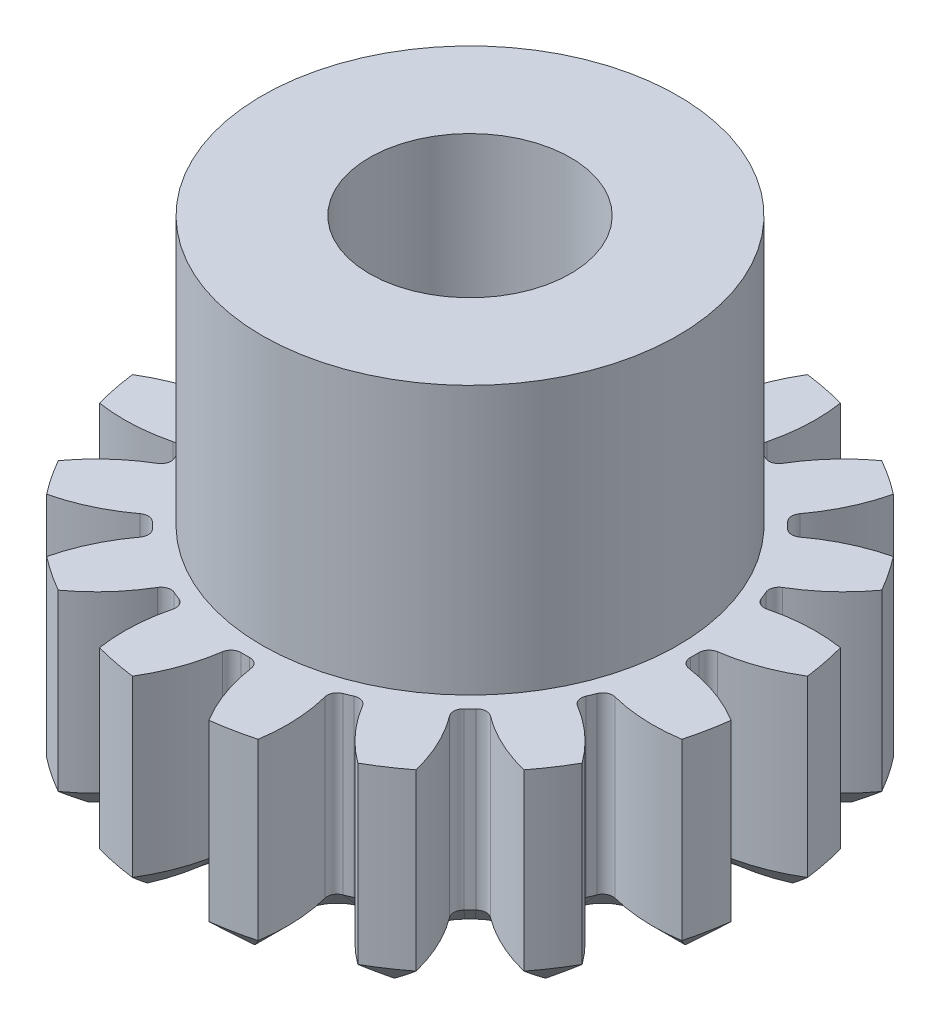
from build123d import *

# Parameters (mm, degrees)
SKETCH1_R                = 4.5
SKETCH1_R_2              = 4
SKETCH1_R_3              = 3.3
BOSS_EXTRUDE1_DEPTH      = 1.5
CUT_EXTRUDE1_DEPTH       = 7.538348415
FILLET2_R                = 0.15
CIRPATTERN1_COUNT        = 16
FILLET2_OF_CIRPATTERN1_R = 0.15
CUT_EXTRUDE2_DEPTH       = 7.488652665
CUT_EXTRUDE2_DEPTH_BACK  = 7.488652665
SKETCH4_R                = 1.5
SKETCH5_R                = 3.1
SKETCH5_R_2              = 1.5
BOSS_EXTRUDE2_DEPTH      = 4
CHAMFER1_SIZE            = 0.4


with BuildPart() as part:
    # Sketch1 → Boss-Extrude1 (new, symmetric)
    # profile 1 of 3: a face of its own
    with BuildSketch(Plane(origin=(0, 0, 0), x_dir=(1, 0, 0), z_dir=(0, 1, 0))):
        with Locations(Location((0, 0, 0), (0, 0, 270))):
            Circle(SKETCH1_R)
        Circle(SKETCH1_R_2, mode=Mode.SUBTRACT)
    # profile 2 of 3: a face of its own
    with BuildSketch(Plane(origin=(0, 0, 0), x_dir=(1, 0, 0), z_dir=(0, 1, 0))):
        Circle(SKETCH1_R_2)
        Circle(SKETCH1_R_3, mode=Mode.SUBTRACT)
    # profile 3 of 3: a face of its own
    with BuildSketch(Plane(origin=(0, 0, 0), x_dir=(1, 0, 0), z_dir=(0, 1, 0))):
        Circle(SKETCH1_R_3)
    extrude(amount=BOSS_EXTRUDE1_DEPTH, both=True)

    # Sketch3 → Cut-Extrude1 (cut, symmetric)
    with BuildSketch(Plane(origin=(0, 0, 0), x_dir=(1, 0, 0), z_dir=(0, 1, 0))):
        with BuildLine():
            ThreePointArc((1.679863237, 5.467765495), (0, 5.72), (-1.679863237, 5.467765495))
            ThreePointArc((-1.679863237, 5.467765495), (-0.658701663, 4.601539237), (-0.198221544, 3.344130413))
            ThreePointArc((-0.198221544, 3.344130413), (0, 3.35), (0.198221544, 3.344130413))
            ThreePointArc((0.198221544, 3.344130413), (0.658701663, 4.601539237), (1.679863237, 5.467765495))
        make_face()
    cut_extrude1 = extrude(amount=CUT_EXTRUDE1_DEPTH, both=True, mode=Mode.SUBTRACT)

    # Fillet2
    fillet2_edges = [part.edges().sort_by_distance(p)[0] for p in [
        (-0.198221544, 0, -3.344130413),
        (0.198221544, 0, -3.344130413),
    ]]
    fillet(fillet2_edges, radius=FILLET2_R)

    # CirPattern1: Cut-Extrude1 ×16 about axis
    cirpattern1_axis = Axis((0, 0, 0), (0, 1, 0))
    for i in range(1, CIRPATTERN1_COUNT):
        add(cut_extrude1.rotate(cirpattern1_axis, i * 360 / CIRPATTERN1_COUNT), mode=Mode.SUBTRACT)

    # Fillet2 of CirPattern1
    fillet2_of_cirpattern1_edges = [part.edges().sort_by_distance(p)[0] for p in [
        (-1.462876132, 0, -3.013717542),
        (-1.096610478, 0, -3.165429743),
        (-2.50482109, 0, -2.224493494),
        (-2.224493494, 0, -2.50482109),
        (-3.165429743, 0, -1.096610478),
        (-3.013717542, 0, -1.462876132),
        (-3.344130413, 0, 0.198221544),
        (-3.344130413, 0, -0.198221544),
        (-3.013717542, 0, 1.462876132),
        (-3.165429743, 0, 1.096610478),
        (-2.224493494, 0, 2.50482109),
        (-2.50482109, 0, 2.224493494),
        (-1.096610478, 0, 3.165429743),
        (-1.462876132, 0, 3.013717542),
        (0.198221544, 0, 3.344130413),
        (-0.198221544, 0, 3.344130413),
        (1.462876132, 0, 3.013717542),
        (1.096610478, 0, 3.165429743),
        (2.50482109, 0, 2.224493494),
        (2.224493494, 0, 2.50482109),
        (3.165429743, 0, 1.096610478),
        (3.013717542, 0, 1.462876132),
        (3.344130413, 0, -0.198221544),
        (3.344130413, 0, 0.198221544),
        (3.013717542, 0, -1.462876132),
        (3.165429743, 0, -1.096610478),
        (2.224493494, 0, -2.50482109),
        (2.50482109, 0, -2.224493494),
        (1.096610478, 0, -3.165429743),
        (1.462876132, 0, -3.013717542),
    ]]
    fillet(fillet2_of_cirpattern1_edges, radius=FILLET2_OF_CIRPATTERN1_R)

    # Sketch4 → Cut-Extrude2 (cut, two sides: drawn at the far end of the back side and taken through both)
    with BuildSketch(Plane(origin=(0, 0, 0), x_dir=(1, 0, 0), z_dir=(0, 1, 0)).offset(-CUT_EXTRUDE2_DEPTH_BACK)):
        with Locations(Location((0, 0, 0), (0, 0, 270))):
            Circle(SKETCH4_R)
    extrude(amount=CUT_EXTRUDE2_DEPTH + CUT_EXTRUDE2_DEPTH_BACK, mode=Mode.SUBTRACT)

    # Sketch5 → Boss-Extrude2 (add)
    with BuildSketch(Plane(origin=(0, 1.5, 0), x_dir=(1, 0, 0), z_dir=(0, 1, 0))):
        with Locations(Location((0, 0, 0), (0, 0, 270))):
            Circle(SKETCH5_R)
        with Locations(Location((0, 0, 0), (0, 0, 270))):
            Circle(SKETCH5_R_2, mode=Mode.SUBTRACT)
    extrude(amount=BOSS_EXTRUDE2_DEPTH)

    # Chamfer1
    chamfer1_edges = [part.edges().sort_by_distance(p)[0] for p in [
        (-1.842208756, -1.5, -3.554329089),
        (-3.06216182, -1.5, -2.578789127),
        (-3.815928505, -1.5, -1.210651898),
        (-3.988754667, -1.5, 0.341796109),
        (-3.554329089, -1.5, 1.842208756),
        (-2.578789127, -1.5, 3.06216182),
        (-1.210651898, -1.5, 3.815928505),
        (0.341796109, -1.5, 3.988754667),
        (1.842208756, -1.5, 3.554329089),
        (3.06216182, -1.5, 2.578789127),
        (3.815928505, -1.5, 1.210651898),
        (3.988754667, -1.5, -0.341796109),
        (3.554329089, -1.5, -1.842208756),
        (2.578789127, -1.5, -3.06216182),
        (1.210651898, -1.5, -3.815928505),
        (0.341796109, -1.5, -3.988754667),
        (0, -1.5, -3.35),
        (0.162785319, -1.5, -3.385033023),
        (-0.162785319, -1.5, -3.385033023),
        (-1.210651898, -1.5, -3.815928505),
        (-1.281989498, -1.5, -3.094996434),
        (-1.145002031, -1.5, -3.189657971),
        (-1.44579008, -1.5, -3.065067482),
        (-2.578789127, -1.5, -3.06216182),
        (-2.368807717, -1.5, -2.368807717),
        (-2.278473202, -1.5, -2.508686408),
        (-2.508686408, -1.5, -2.278473202),
        (-3.554329089, -1.5, -1.842208756),
        (-3.094996434, -1.5, -1.281989498),
        (-3.065067482, -1.5, -1.44579008),
        (-3.189657971, -1.5, -1.145002031),
        (-3.988754667, -1.5, -0.341796109),
        (-3.35, -1.5, 0),
        (-3.385033023, -1.5, -0.162785319),
        (-3.385033023, -1.5, 0.162785319),
        (-3.815928505, -1.5, 1.210651898),
        (-3.094996434, -1.5, 1.281989498),
        (-3.189657971, -1.5, 1.145002031),
        (-3.065067482, -1.5, 1.44579008),
        (-2.500066049, -1.5, -3.741613255),
        (-3.06216182, -1.5, 2.578789127),
        (-2.368807717, -1.5, 2.368807717),
        (-3.741613255, -1.5, -2.500066049),
        (-2.508686408, -1.5, 2.278473202),
        (-2.278473202, -1.5, 2.508686408),
        (-4.413533762, -1.5, -0.877906449),
        (-1.842208756, -1.5, 3.554329089),
        (-1.281989498, -1.5, 3.094996434),
        (-4.413533762, -1.5, 0.877906449),
        (-1.44579008, -1.5, 3.065067482),
        (-1.145002031, -1.5, 3.189657971),
        (-3.741613255, -1.5, 2.500066049),
        (-2.500066049, -1.5, 3.741613255),
        (-0.341796109, -1.5, 3.988754667),
        (0, -1.5, 3.35),
        (-0.877906449, -1.5, 4.413533762),
        (-0.162785319, -1.5, 3.385033023),
        (0.162785319, -1.5, 3.385033023),
        (0.877906449, -1.5, 4.413533762),
        (1.210651898, -1.5, 3.815928505),
        (1.281989498, -1.5, 3.094996434),
        (2.500066049, -1.5, 3.741613255),
        (1.145002031, -1.5, 3.189657971),
        (1.44579008, -1.5, 3.065067482),
        (3.741613255, -1.5, 2.500066049),
        (2.578789127, -1.5, 3.06216182),
        (4.413533762, -1.5, 0.877906449),
        (2.368807717, -1.5, 2.368807717),
        (2.278473202, -1.5, 2.508686408),
        (4.413533762, -1.5, -0.877906449),
        (2.508686408, -1.5, 2.278473202),
        (3.741613255, -1.5, -2.500066049),
        (3.554329089, -1.5, 1.842208756),
        (3.094996434, -1.5, 1.281989498),
        (2.500066049, -1.5, -3.741613255),
        (3.065067482, -1.5, 1.44579008),
        (3.189657971, -1.5, 1.145002031),
        (0.877906449, -1.5, -4.413533762),
        (3.988754667, -1.5, 0.341796109),
        (3.35, -1.5, 0),
        (3.385033023, -1.5, 0.162785319),
        (3.385033023, -1.5, -0.162785319),
        (3.815928505, -1.5, -1.210651898),
        (3.094996434, -1.5, -1.281989498),
        (3.189657971, -1.5, -1.145002031),
        (3.065067482, -1.5, -1.44579008),
        (3.06216182, -1.5, -2.578789127),
        (2.368807717, -1.5, -2.368807717),
        (2.508686408, -1.5, -2.278473202),
        (2.278473202, -1.5, -2.508686408),
        (1.842208756, -1.5, -3.554329089),
        (1.281989498, -1.5, -3.094996434),
        (1.44579008, -1.5, -3.065067482),
        (1.145002031, -1.5, -3.189657971),
        (0, -1.5, -1.5),
        (-0.877906449, -1.5, -4.413533762),
        (-0.341796109, -1.5, -3.988754667),
    ]]
    chamfer(chamfer1_edges, length=CHAMFER1_SIZE)


solid = part.part
